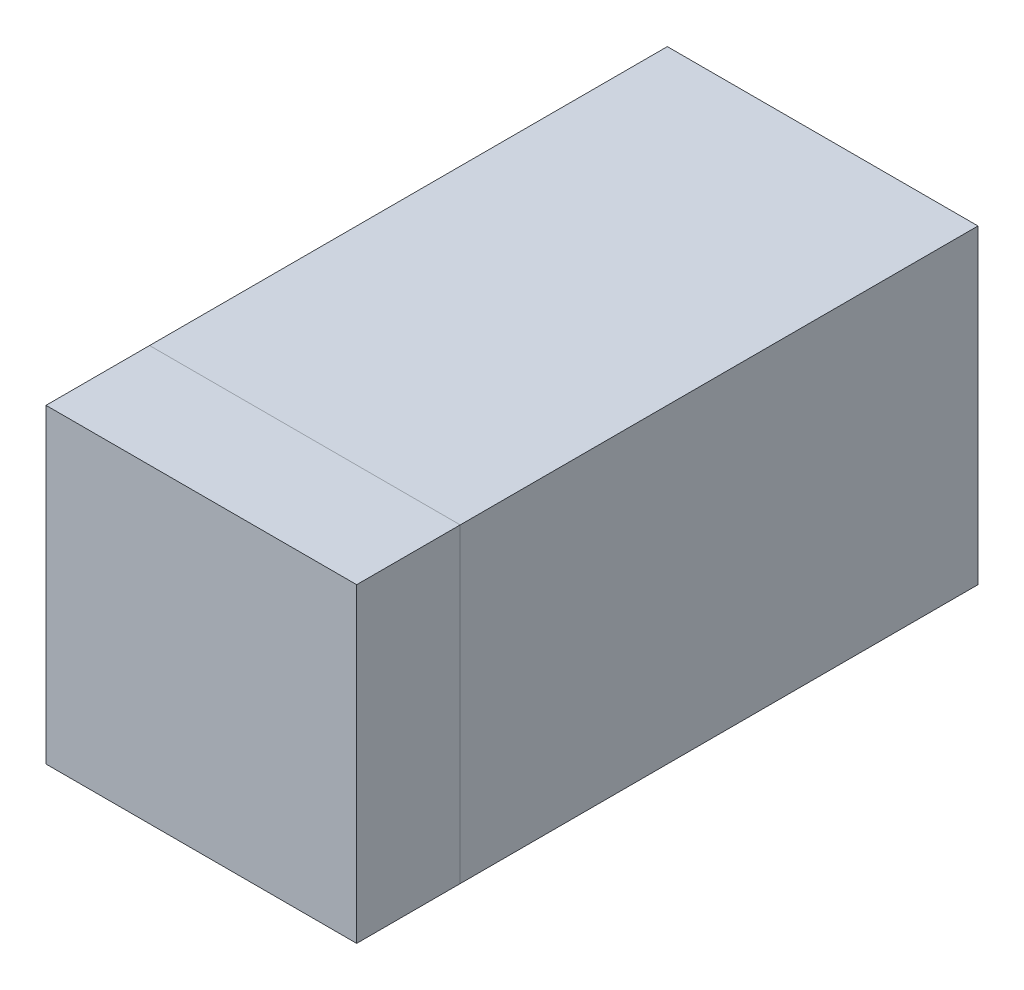
from build123d import *

# Parameters (mm, degrees)
SKETCH1_W             = 76.2
SKETCH1_H             = 76.2
BOSS_EXTRUDE1_DEPTH   = 127
SKETCH4_W             = 76.2
SKETCH4_H             = 76.2
BOSS_EXTRUDE4_DEPTH   = 25.4
SKETCH2_W             = 15.875
SKETCH2_H             = 127
BOSS_EXTRUDE3_DEPTH   = 2.54
BOSS_EXTRUDE3_2_DEPTH = 2.54


with BuildPart() as part:
    # Sketch1 → Boss-Extrude1 (new body)
    with BuildSketch(Plane.XY):
        with Locations((38.1, 38.1)):
            Rectangle(SKETCH1_W, SKETCH1_H)
    extrude(amount=BOSS_EXTRUDE1_DEPTH)


with BuildPart() as body_2:
    # Sketch4 → Boss-Extrude4 (new body)
    with BuildSketch(Plane.XY.offset(127)):
        with Locations((38.1, 38.1)):
            Rectangle(SKETCH4_W, SKETCH4_H)
    extrude(amount=BOSS_EXTRUDE4_DEPTH)


with BuildPart() as body_3:
    # Sketch2 → Boss-Extrude3 (new body)
    with BuildSketch(Plane.XZ):
        with Locations((20.6375, 76.2)):
            Rectangle(SKETCH2_W, SKETCH2_H)
    extrude(amount=BOSS_EXTRUDE3_DEPTH)


with BuildPart() as body_4:
    # Sketch2 → Boss-Extrude3 2 (new body)
    with BuildSketch(Plane.XZ):
        with Locations((55.5625, 76.2)):
            Rectangle(SKETCH2_W, SKETCH2_H)
    extrude(amount=BOSS_EXTRUDE3_2_DEPTH)


solid = Compound([part.part, body_2.part, body_3.part, body_4.part])
